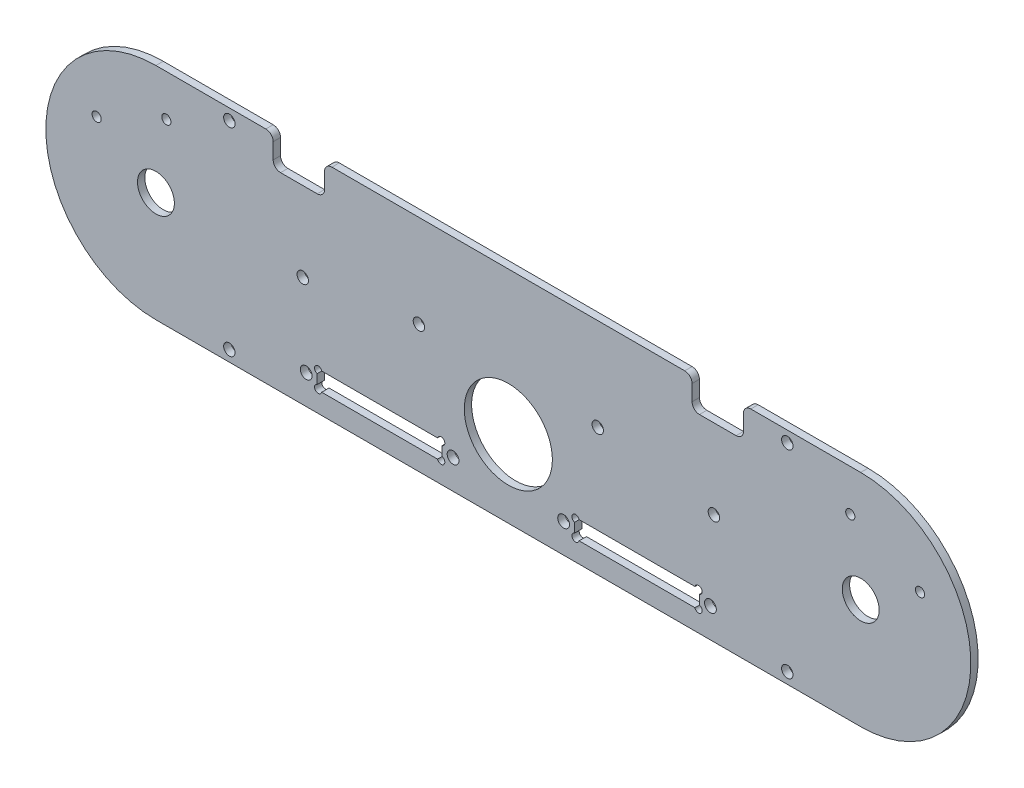
from build123d import *

# Parameters (mm, degrees)
EXTRUDE_1_DEPTH     = 2
SKETCH_2_R          = 1.55
SKETCH_2_R_2        = 12
SKETCH_2_R_3        = 5.025
SKETCH_2_R_4        = 1.25
CUT_EXTRUDE_1_DEPTH = 130.537639318
SKETCH_3_R          = 1.6
SKETCH_3_W          = 34
SKETCH_3_H          = 5
CUT_EXTRUDE_2_DEPTH = 130.537639318
SKETCH_4_W          = 14
SKETCH_4_H          = 8.3
CUT_EXTRUDE_3_DEPTH = 130.537639318
FILLET_1_R          = 2
SKETCH_5_R          = 1
CUT_EXTRUDE_4_DEPTH = 130.537639318


with BuildPart() as part:
    # ｽｹｯﾁ1 → ﾎﾞｽ - 押し出し1 (new body)
    with BuildSketch(Plane.XY):
        with BuildLine():
            Line((-96, -30), (96, -30))
            ThreePointArc((96, -30), (126, 0), (96, 30))
            Line((96, 30), (-96, 30))
            ThreePointArc((-96, 30), (-126, 0), (-96, -30))
        make_face()
    extrude(amount=EXTRUDE_1_DEPTH)

    # ｽｹｯﾁ2 → ｶｯﾄ - 押し出し1 (cut, through all)
    with BuildSketch(Plane.XY.offset(2)):
        with Locations((-56, 0)):
            Circle(SKETCH_2_R)
        with Locations(Location((56, 0, 0), (0, 0, 180))):
            Circle(SKETCH_2_R)
        with Locations((-76, 27)):
            Circle(SKETCH_2_R)
        with Locations((-76, -27)):
            Circle(SKETCH_2_R)
        with Locations(Location((76, 27, 0), (0, 0, 180))):
            Circle(SKETCH_2_R)
        with Locations(Location((76, -27, 0), (0, 0, 180))):
            Circle(SKETCH_2_R)
        with Locations((-24.362267564, 4.80144627)):
            Circle(SKETCH_2_R)
        with Locations(Location((24.362267564, 4.80144627, 0), (0, 0, 180))):
            Circle(SKETCH_2_R)
        with Locations((0, -9)):
            Circle(SKETCH_2_R_2)
        with Locations((-96, 0)):
            Circle(SKETCH_2_R_3)
        with Locations((96, 0)):
            Circle(SKETCH_2_R_3)
        with Locations((-112.152077461, 9.846364808)):
            Circle(SKETCH_2_R_4)
        with Locations((-93.160397784, 18.702330483)):
            Circle(SKETCH_2_R_4)
        with Locations(Location((93.160397784, 18.702330483, 0), (0, 0, 180))):
            Circle(SKETCH_2_R_4)
        with Locations(Location((112.152077461, 9.846364808, 0), (0, 0, 180))):
            Circle(SKETCH_2_R_4)
    extrude(amount=-CUT_EXTRUDE_1_DEPTH, mode=Mode.SUBTRACT)

    # ｽｹｯﾁ3 → ｶｯﾄ - 押し出し2 (cut, through all)
    with BuildSketch(Plane.XY.offset(2)):
        with Locations((55.057299255, -22)):
            Circle(SKETCH_3_R)
        with Locations((15.057299255, -22)):
            Circle(SKETCH_3_R)
        with Locations(Location((-55.057299255, -22, 0), (0, 0, 180))):
            Circle(SKETCH_3_R)
        with Locations(Location((-15.057299255, -22, 0), (0, 0, 180))):
            Circle(SKETCH_3_R)
        with Locations((35.057299255, -22)):
            Rectangle(SKETCH_3_W, SKETCH_3_H)
        with Locations((-35.057299255, -22)):
            Rectangle(SKETCH_3_W, SKETCH_3_H)
    extrude(amount=-CUT_EXTRUDE_2_DEPTH, mode=Mode.SUBTRACT)

    # ｽｹｯﾁ4 → ｶｯﾄ - 押し出し3 (cut, through all)
    with BuildSketch(Plane.XY.offset(2)):
        with Locations((-57.057299255, 25.85)):
            Rectangle(SKETCH_4_W, SKETCH_4_H)
        with Locations((57.057299255, 25.85)):
            Rectangle(SKETCH_4_W, SKETCH_4_H)
    extrude(amount=-CUT_EXTRUDE_3_DEPTH, mode=Mode.SUBTRACT)

    # ﾌｨﾚｯﾄ1
    fillet_1_edges = [part.edges().sort_by_distance(p)[0] for p in [
        (-64.057299255, 21.7, 1),
        (-64.057299255, 30, 1),
        (-50.057299255, 30, 1),
        (-50.057299255, 21.7, 1),
        (50.057299255, 21.7, 1),
        (50.057299255, 30, 1),
        (64.057299255, 30, 1),
        (64.057299255, 21.7, 1),
    ]]
    fillet(fillet_1_edges, radius=FILLET_1_R)

    # ｽｹｯﾁ5 → ｶｯﾄ - 押し出し4 (cut, through all)
    with BuildSketch(Plane.XY.offset(2)):
        with Locations((-51.807299255, -19.75)):
            Circle(SKETCH_5_R)
        with Locations((-51.807299255, -24.25)):
            Circle(SKETCH_5_R)
        with Locations((-18.307299255, -24.25)):
            Circle(SKETCH_5_R)
        with Locations((-18.307299255, -19.75)):
            Circle(SKETCH_5_R)
        with Locations((18.307299255, -19.75)):
            Circle(SKETCH_5_R)
        with Locations((18.307299255, -24.25)):
            Circle(SKETCH_5_R)
        with Locations((51.807299255, -24.25)):
            Circle(SKETCH_5_R)
        with Locations((51.807299255, -19.75)):
            Circle(SKETCH_5_R)
    extrude(amount=-CUT_EXTRUDE_4_DEPTH, mode=Mode.SUBTRACT)


solid = part.part
